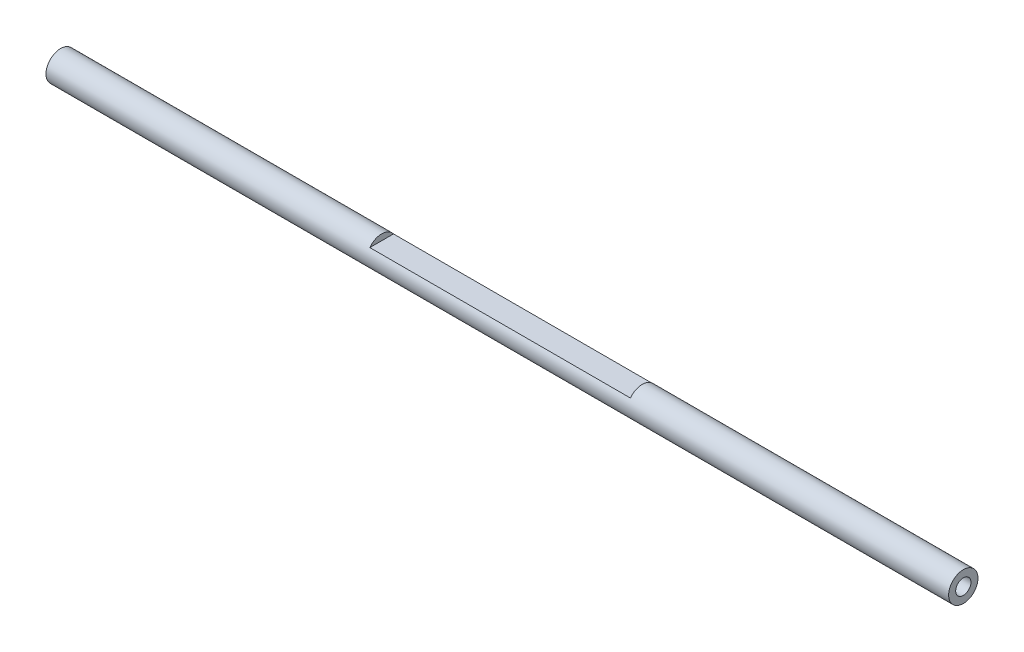
from build123d import *

# Parameters (mm, degrees)
SKETCH1_W               = 20
SKETCH1_H               = 16.9
BOSS_EXTRUDE1_DEPTH     = 23.75
SKETCH2_R               = 8.45
BOSS_EXTRUDE2_DEPTH     = 236
SKETCH6_R               = 18.45
SKETCH6_R_2             = 8.45
CUT_EXTRUDE_THIN1_DEPTH = 30
CUT_EXTRUDE1_START      = 5
SKETCH7_W               = 150
SKETCH7_H               = 40
CUT_EXTRUDE1_DEPTH      = 10


with BuildPart() as part:
    # Sketch1 → Boss-Extrude1 (new, symmetric)
    with BuildSketch(Plane(origin=(0, 0, 0), x_dir=(0, 0, -1), z_dir=(1, 0, 0))):
        Rectangle(SKETCH1_W, SKETCH1_H)
    extrude(amount=BOSS_EXTRUDE1_DEPTH, both=True)

    # Sketch2 → Boss-Extrude2 (add)
    with BuildSketch(Plane(origin=(23.75, 0, 0), x_dir=(0, 0, -1), z_dir=(1, 0, 0))):
        with Locations(Location((0, 0, 0), (0, 0, 270))):
            Circle(SKETCH2_R)
    boss_extrude2 = extrude(amount=BOSS_EXTRUDE2_DEPTH)

    # Sketch3 → M10x1.25 Tapped Hole1 (revolve, cut)
    with BuildSketch(Plane(origin=(259.75, 0, 0), x_dir=(0, 0, -1), z_dir=(0, 1, 0))):
        Polygon((0, 0), (0, 32.643786724), (4.4, 30), (4.4, 0), align=None)
    m10x1_25_tapped_hole1 = revolve(axis=Axis((266.1, 0, 0), (-1, 0, 0)), mode=Mode.SUBTRACT)

    # Mirror1: Boss-Extrude2, M10x1.25 Tapped Hole1 across plane
    add(boss_extrude2.mirror(Plane(origin=(0, 0, 0), x_dir=(0, 0, 1), z_dir=(1, 0, 0))))
    add(m10x1_25_tapped_hole1.mirror(Plane(origin=(0, 0, 0), x_dir=(0, 0, 1), z_dir=(1, 0, 0))), mode=Mode.SUBTRACT)

    # Sketch6 → Cut-Extrude-Thin1 (cut, symmetric)
    with BuildSketch(Plane(origin=(0, 0, 0), x_dir=(0, 0, -1), z_dir=(1, 0, 0))):
        Circle(SKETCH6_R)
        Circle(SKETCH6_R_2, mode=Mode.SUBTRACT)
    extrude(amount=CUT_EXTRUDE_THIN1_DEPTH, both=True, mode=Mode.SUBTRACT)

    # Sketch7 → Cut-Extrude1 (cut)
    with BuildSketch(Plane(origin=(0, 0, 0), x_dir=(1, 0, 0), z_dir=(0, 1, 0)).offset(CUT_EXTRUDE1_START)):
        Rectangle(SKETCH7_W, SKETCH7_H)
    extrude(amount=CUT_EXTRUDE1_DEPTH, mode=Mode.SUBTRACT)


solid = part.part
